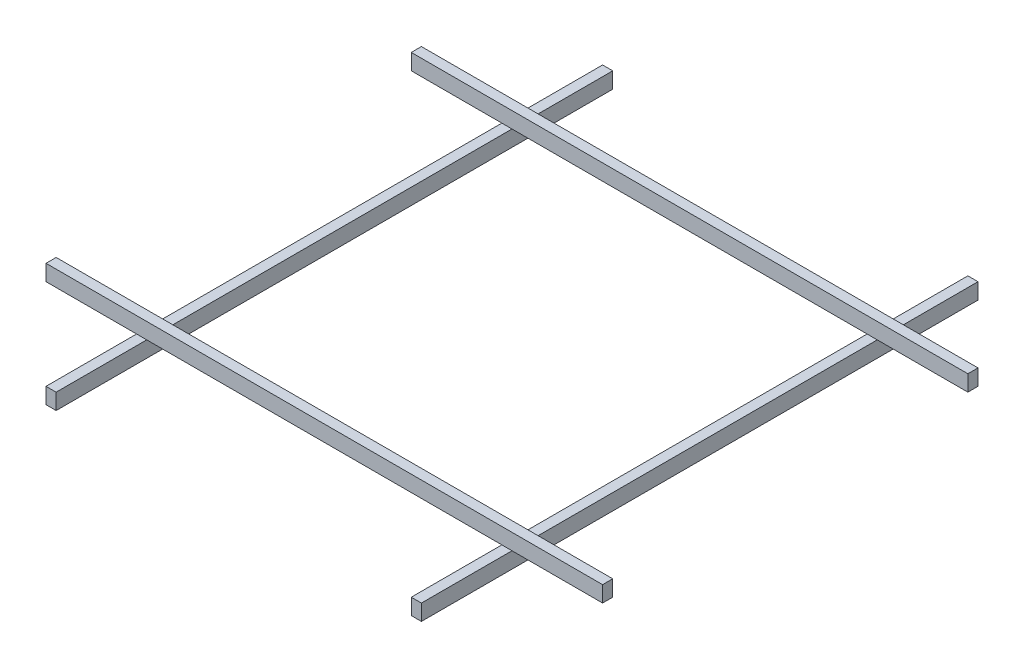
from build123d import *

# Parameters (mm, degrees)
SKETCH1_W              = 88.9
SKETCH1_H              = 139.7
PROFILES_4X6_1_DEPTH   = 4876.8
SKETCH1_ON_SEGMENT_2_W = 88.9
SKETCH1_ON_SEGMENT_2_H = 139.7
PROFILES_4X6_1_2_DEPTH = 4876.8
SKETCH1_ON_SEGMENT_3_W = 88.9
SKETCH1_ON_SEGMENT_3_H = 139.7
PROFILES_4X6_1_3_DEPTH = 4876.8
SKETCH1_ON_SEGMENT_4_W = 88.9
SKETCH1_ON_SEGMENT_4_H = 139.7
PROFILES_4X6_1_4_DEPTH = 4876.8


with BuildPart() as part:
    # Sketch1 → Profiles 4X6(1) (new body)
    with BuildSketch(Plane(origin=(533.4, 0, 0), x_dir=(-1, 0, 0), z_dir=(0, 0, -1))):
        Rectangle(SKETCH1_W, SKETCH1_H)
    extrude(amount=PROFILES_4X6_1_DEPTH)


with BuildPart() as body_2:
    # Sketch1 on segment 2 (carried to segment 2) → Profiles 4X6_1 2 (new body)
    with BuildSketch(Plane(origin=(3733.8, 0, 0), x_dir=(-1, 0, 0), z_dir=(0, 0, -1))):
        Rectangle(SKETCH1_ON_SEGMENT_2_W, SKETCH1_ON_SEGMENT_2_H)
    extrude(amount=PROFILES_4X6_1_2_DEPTH)


with BuildPart() as body_3:
    # Sketch1 on segment 3 (carried to segment 3) → Profiles 4X6_1 3 (new body)
    with BuildSketch(Plane(origin=(-304.8, 139.7, -4038.6), x_dir=(0, 0, -1), z_dir=(1, 0, 0))):
        Rectangle(SKETCH1_ON_SEGMENT_3_W, SKETCH1_ON_SEGMENT_3_H)
    extrude(amount=PROFILES_4X6_1_3_DEPTH)


with BuildPart() as body_4:
    # Sketch1 on segment 4 (carried to segment 4) → Profiles 4X6_1 4 (new body)
    with BuildSketch(Plane(origin=(4572, 139.7, -838.2), x_dir=(0, 0, 1), z_dir=(-1, 0, 0))):
        Rectangle(SKETCH1_ON_SEGMENT_4_W, SKETCH1_ON_SEGMENT_4_H)
    extrude(amount=PROFILES_4X6_1_4_DEPTH)


solid = Compound([part.part, body_2.part, body_3.part, body_4.part])
